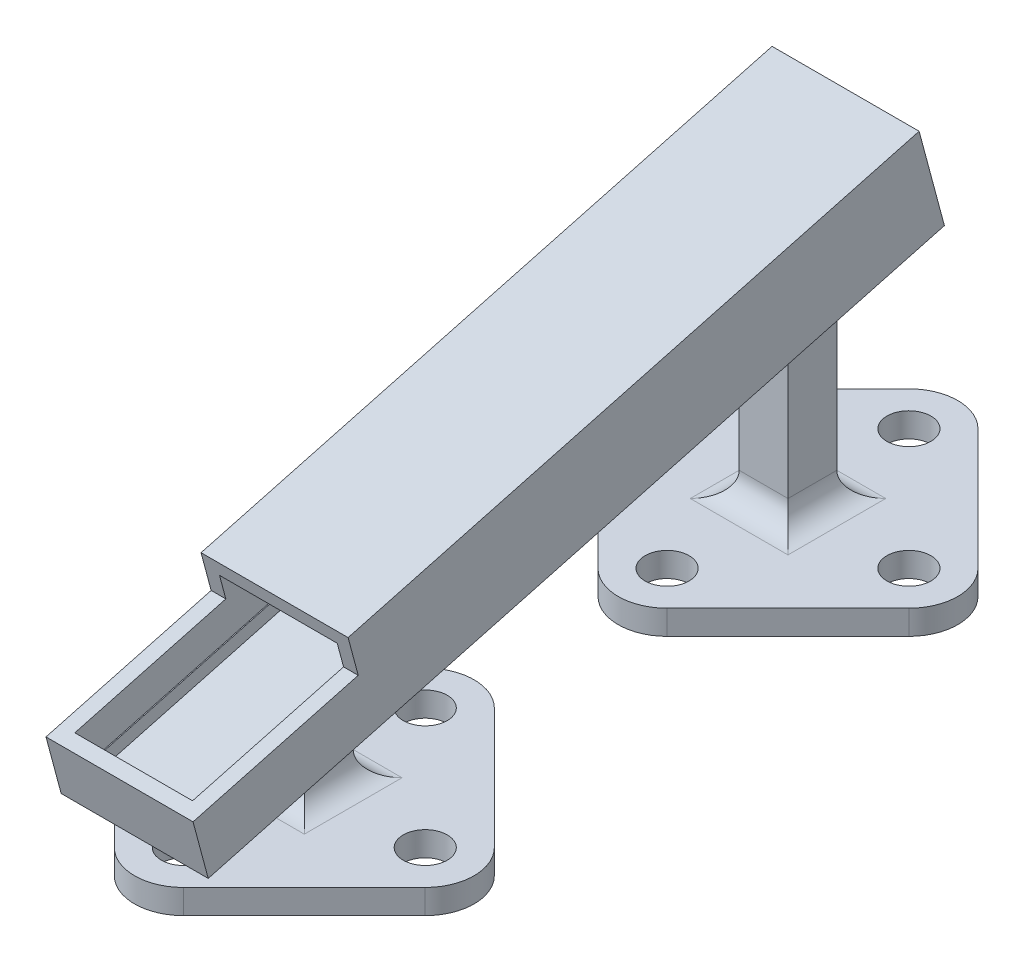
from build123d import *

# Parameters (mm, degrees)
SKETCH1_R                = 4.5
BOSS_EXTRUDE1_DEPTH      = 2.5
SKETCH2_W                = 10
SKETCH2_H                = 45
BOSS_EXTRUDE2_DEPTH      = 5
CUT_EXTRUDE1_DEPTH       = 147.126229678
CUT_EXTRUDE1_DEPTH_BACK  = 147.126229678
BOSS_EXTRUDE3_DEPTH      = 12.05
FILLET1_R                = 5
FILLET2_R                = 5
BOSS_EXTRUDE4_DEPTH      = 10
BOSS_EXTRUDE4_DEPTH_BACK = 2.000004
SKETCH6_W                = 30.1
SKETCH6_H                = 156
SKETCH6_W_2              = 24.1
SKETCH6_H_2              = 150
BOSS_EXTRUDE5_DEPTH      = 5
SKETCH8_W                = 30.1
SKETCH8_H                = 121
BOSS_EXTRUDE6_DEPTH      = 3
CUT_EXTRUDE2_REACH       = 179.268
SKETCH10_W               = 24.1
SKETCH10_H               = 15
SKETCH11_W               = 0.2
SKETCH11_H               = 2.7
BOSS_EXTRUDE7_DEPTH      = 153


with BuildPart() as part:
    # Sketch1 → Boss-Extrude1 (new, symmetric)
    with BuildSketch(Plane(origin=(0, 0, 0), x_dir=(1, 0, 0), z_dir=(0, 1, 0))):
        with BuildLine():
            Line((-31.821067812, 7.071067812), (-7.071067812, 31.821067812))
            ThreePointArc((-7.071067812, 31.821067812), (0, 34.75), (7.071067812, 31.821067812))
            Line((7.071067812, 31.821067812), (31.821067812, 7.071067812))
            ThreePointArc((31.821067812, 7.071067812), (34.75, 0), (31.821067812, -7.071067812))
            Line((31.821067812, -7.071067812), (7.071067812, -31.821067812))
            ThreePointArc((7.071067812, -31.821067812), (0, -34.75), (-7.071067812, -31.821067812))
            Line((-7.071067812, -31.821067812), (-31.821067812, -7.071067812))
            ThreePointArc((-31.821067812, -7.071067812), (-34.75, 0), (-31.821067812, 7.071067812))
        make_face()
        with Locations(Location((0, 24.75, 0), (0, 0, 270))):
            Circle(SKETCH1_R, mode=Mode.SUBTRACT)
        with Locations(Location((24.75, 0, 0), (0, 0, 270))):
            Circle(SKETCH1_R, mode=Mode.SUBTRACT)
        with Locations(Location((0, -24.75, 0), (0, 0, 270))):
            Circle(SKETCH1_R, mode=Mode.SUBTRACT)
        with Locations(Location((-24.75, 0, 0), (0, 0, 270))):
            Circle(SKETCH1_R, mode=Mode.SUBTRACT)
    extrude(amount=BOSS_EXTRUDE1_DEPTH, both=True)


with BuildPart() as body_2:
    # Mirror3: mirrored copy
    add(part.part.mirror(Plane.XY.offset(49.5)))


with BuildPart() as body_3:
    # Sketch2 → Boss-Extrude2 (new, symmetric)
    with BuildSketch(Plane(origin=(0, 0, 0), x_dir=(0, 0, -1), z_dir=(1, 0, 0))):
        with Locations((-99, 25)):
            Rectangle(SKETCH2_W, SKETCH2_H)
    extrude(amount=BOSS_EXTRUDE2_DEPTH, both=True)


with BuildPart() as body_4:
    # Mirror5: mirrored copy
    add(body_3.part.mirror(Plane.XY.offset(49.5)))


with BuildPart() as cut_extrude1_tool:
    # Sketch3 → Cut-Extrude1 (new, two sides: drawn at the far end of the back side and taken through both)
    with BuildSketch(Plane(origin=(0, 0, 0), x_dir=(0, 0, -1), z_dir=(1, 0, 0)).offset(-CUT_EXTRUDE1_DEPTH_BACK)):
        Polygon((-398.060619113, -61.293305417), (-104, 17.5), (5, 46.706461975), (299.060619113, 125.499767392), (141.474008279, 713.621005618), (-555.647229947, 526.827932809), align=None)
    extrude(amount=CUT_EXTRUDE1_DEPTH + CUT_EXTRUDE1_DEPTH_BACK)


with BuildPart() as body_3_1:
    add(body_3.part)

    # Cut-Extrude1: cut by cut_extrude1_tool
    add(cut_extrude1_tool.part, mode=Mode.SUBTRACT)


with BuildPart() as body_4_1:
    add(body_4.part)

    # Cut-Extrude1: cut by cut_extrude1_tool
    add(cut_extrude1_tool.part, mode=Mode.SUBTRACT)

    # Combine2: union part
    add(part.part)

    # Fillet2
    fillet2_edges = [body_4_1.edges().sort_by_distance(p)[0] for p in [
        (-5, 2.5, 0),
        (0, 2.5, 5),
        (0, 2.5, -5),
        (5, 2.5, 0),
    ]]
    fillet(fillet2_edges, radius=FILLET2_R)


with BuildPart() as body_5:
    # Sketch4 → Boss-Extrude3 (new, symmetric)
    with BuildSketch(Plane(origin=(0, 0, 0), x_dir=(0, 0, -1), z_dir=(1, 0, 0))):
        Polygon((-130.821067812, 10.31331654), (14.067806131, 49.136173305), (13.550168041, 51.068024958), (-131.338705902, 12.245168192), align=None)
    extrude(amount=BOSS_EXTRUDE3_DEPTH, both=True)



with BuildPart() as body_2_1:
    add(body_2.part)

    # Combine1: union body 3
    add(body_3_1.part)

    # Fillet1
    fillet1_edges = [body_2_1.edges().sort_by_distance(p)[0] for p in [
        (0, 2.5, 94),
        (5, 2.5, 99),
        (-5, 2.5, 99),
        (0, 2.5, 104),
    ]]
    fillet(fillet1_edges, radius=FILLET1_R)


with BuildPart() as body_5_1:
    add(body_5.part)

    add(body_2_1.part)  # Boss-Extrude4 merges body 2

    add(body_4_1.part)  # Boss-Extrude4 merges body 4
    # Sketch6 → Boss-Extrude4 (add, two sides: drawn at the far end of the back side and taken through both)
    with BuildSketch(Plane(origin=(0, 44.259573936, 11.859317093), x_dir=(1, 0, 0), z_dir=(0, 0.96592582628907, 0.2588190451025143)).offset(-BOSS_EXTRUDE4_DEPTH_BACK)):
        with Locations((0, -48.694165284)):
            Rectangle(SKETCH6_W, SKETCH6_H)
        with Locations((0, -48.694165284)):
            Rectangle(SKETCH6_W_2, SKETCH6_H_2, mode=Mode.SUBTRACT)
    extrude(amount=BOSS_EXTRUDE4_DEPTH + BOSS_EXTRUDE4_DEPTH_BACK)

    # Sketch7 → Boss-Extrude5 (add)
    with BuildSketch(Plane(origin=(0, 53.918832199, 14.447507544), x_dir=(1, 0, 0), z_dir=(0, 0.96592582628907, 0.25881904510251436))):
        Polygon((12.05, 26.305834716), (12.05, -91.694165284), (15.05, -91.694165284), (15.05, 29.305834716), (-15.05, 29.305834716), (-15.05, -91.694165284), (-12.05, -91.694165284), (-12.05, 26.305834716), align=None)
    extrude(amount=BOSS_EXTRUDE5_DEPTH)

    # Sketch8 → Boss-Extrude6 (add)
    with BuildSketch(Plane(origin=(0, 58.74846133, 15.74160277), x_dir=(1, 0, 0), z_dir=(0, 0.96592582628907, 0.25881904510251436))):
        with Locations((0, -31.194165284)):
            Rectangle(SKETCH8_W, SKETCH8_H)
    extrude(amount=BOSS_EXTRUDE6_DEPTH)

    # Sketch10 → Cut-Extrude2 (cut, up to next)
    with BuildSketch(Plane(origin=(0, 6.808451022, -25.409485135), x_dir=(1, 0, 0), z_dir=(0, -0.2588190451025143, 0.96592582628907)), mode=Mode.PRIVATE) as cut_extrude2_sk1:
        with Locations((0, 53.320882651)):
            Rectangle(SKETCH10_W, SKETCH10_H)
    cut_extrude2_tool1 = extrude(cut_extrude2_sk1.sketch, amount=-CUT_EXTRUDE2_REACH, mode=Mode.PRIVATE) & body_5_1.part
    add(cut_extrude2_tool1.solids().sort_by_distance((0, 58.312469, -11.609025))[0], mode=Mode.SUBTRACT)

    # Sketch11 → Boss-Extrude7 (add)
    with BuildSketch(Plane(origin=(0, 7.584908157, -28.307262614), x_dir=(-1, 0, 0), z_dir=(0, 0.2588190451025143, -0.96592582628907))):
        with Locations((-11.95, 47.170882651)):
            Rectangle(SKETCH11_W, SKETCH11_H)
        with Locations((11.95, 47.170882651)):
            Rectangle(SKETCH11_W, SKETCH11_H)
    extrude(amount=-BOSS_EXTRUDE7_DEPTH)


solid = body_5_1.part
